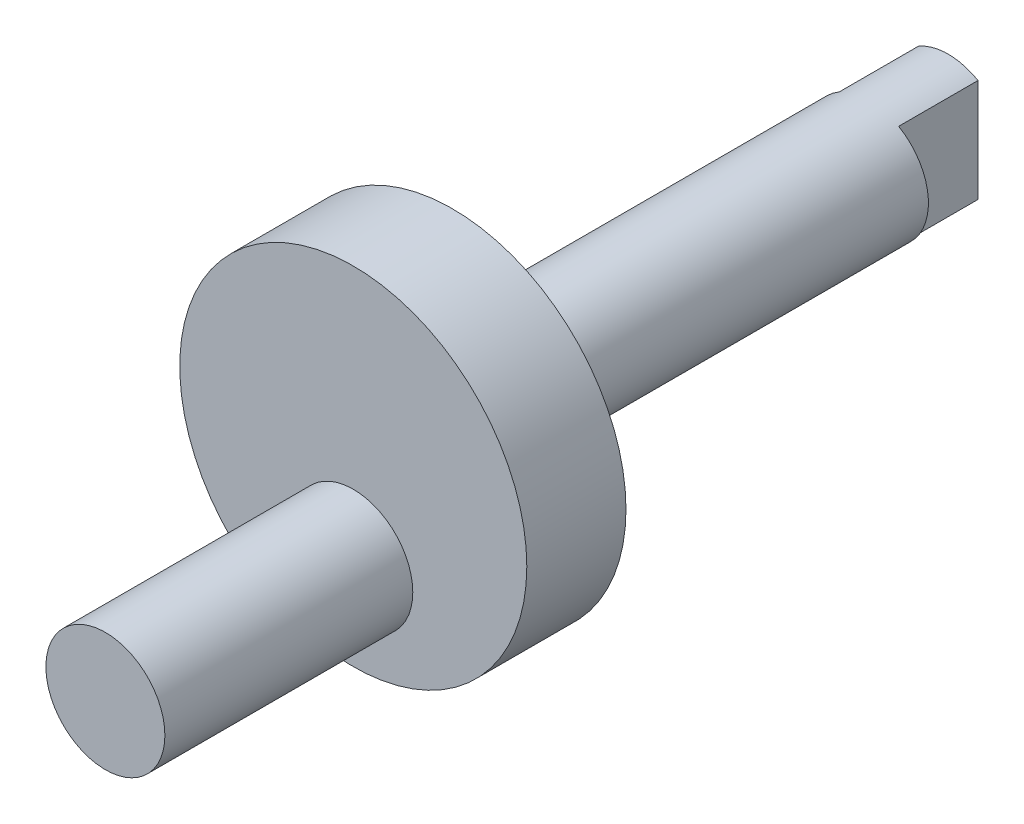
from build123d import *

# Parameters (mm, degrees)
SKETCH1_R           = 6
BOSS_EXTRUDE1_DEPTH = 50
SKETCH2_R           = 17.5
BOSS_EXTRUDE2_DEPTH = 10
SKETCH3_R           = 6
BOSS_EXTRUDE3_DEPTH = 25
SKETCH4_OUTSIDE_W   = 56.672
SKETCH4_OUTSIDE_H   = 56.672
SKETCH4_OUTSIDE_W_2 = 6
SKETCH4_OUTSIDE_H_2 = 12
CUT_EXTRUDE2_DEPTH  = 8


with BuildPart() as part:
    # Sketch1 → Boss-Extrude1 (new body)
    with BuildSketch(Plane.XY):
        Circle(SKETCH1_R)
    extrude(amount=BOSS_EXTRUDE1_DEPTH)

    # Sketch2 → Boss-Extrude2 (add)
    with BuildSketch(Plane.XY.offset(50)):
        Circle(SKETCH2_R)
    extrude(amount=BOSS_EXTRUDE2_DEPTH)

    # Sketch3 → Boss-Extrude3 (add)
    with BuildSketch(Plane.XY.offset(60)):
        with Locations((0, -8)):
            Circle(SKETCH3_R)
    extrude(amount=BOSS_EXTRUDE3_DEPTH)

    # Sketch4 outside → Cut-Extrude2 (cut)
    with BuildSketch(Plane(origin=(0, 0, 0), x_dir=(-1, 0, 0), z_dir=(0, 0, -1))):
        Rectangle(SKETCH4_OUTSIDE_W, SKETCH4_OUTSIDE_H)
        Rectangle(SKETCH4_OUTSIDE_W_2, SKETCH4_OUTSIDE_H_2, mode=Mode.SUBTRACT)
    extrude(amount=-CUT_EXTRUDE2_DEPTH, mode=Mode.SUBTRACT)


solid = part.part
